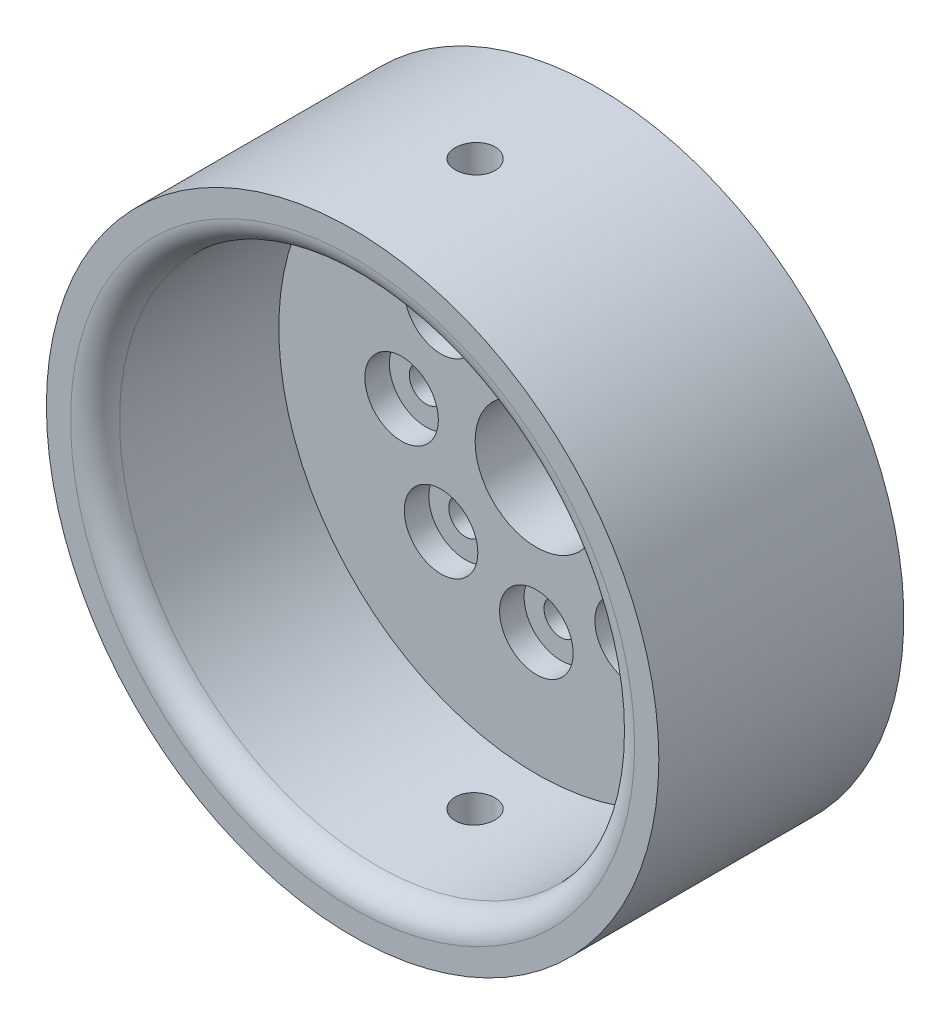
from build123d import *
from build123d.topology import SkipClean

# Parameters (mm, degrees)
SKETCH1_R               = 25
SKETCH1_R_2             = 20.15
BOSS_EXTRUDE1_DEPTH     = 10
BOSS_EXTRUDE2_START     = 5
SKETCH2_R               = 25
SKETCH2_R_2             = 1.375
SKETCH2_R_3             = 5
BOSS_EXTRUDE2_DEPTH     = 5
SKETCH3_R               = 3
CUT_EXTRUDE1_DEPTH      = 2
CUT_EXTRUDE2_DEPTH      = 38
CUT_EXTRUDE2_DEPTH_BACK = 33
SKETCH4_R               = 1.625
SKETCH5_R               = 21.025
CUT_EXTRUDE3_DEPTH      = 10
SKETCH6_R               = 25
SKETCH6_R_2             = 21.025
BOSS_EXTRUDE3_DEPTH     = 5
FILLET1_R               = 2


with BuildPart() as part:
    # Sketch1 → Boss-Extrude1 (new body)
    with BuildSketch(Plane.XY):
        Circle(SKETCH1_R)
        Circle(SKETCH1_R_2, mode=Mode.SUBTRACT)
    extrude(amount=BOSS_EXTRUDE1_DEPTH)

    # Sketch2 → Boss-Extrude2 (add)
    with BuildSketch(Plane(origin=(0, 0, 0), x_dir=(-1, 0, 0), z_dir=(0, 0, -1)).offset(BOSS_EXTRUDE2_START)):
        Circle(SKETCH2_R)
        with Locations((-11, 0)):
            Circle(SKETCH2_R_2, mode=Mode.SUBTRACT)
        with Locations((-7.778174593, 7.778174593)):
            Circle(SKETCH2_R_2, mode=Mode.SUBTRACT)
        with Locations((0, 11)):
            Circle(SKETCH2_R_2, mode=Mode.SUBTRACT)
        with Locations((7.778174593, 7.778174593)):
            Circle(SKETCH2_R_2, mode=Mode.SUBTRACT)
        with Locations((11, 0)):
            Circle(SKETCH2_R_2, mode=Mode.SUBTRACT)
        with Locations((7.778174593, -7.778174593)):
            Circle(SKETCH2_R_2, mode=Mode.SUBTRACT)
        with Locations((0, -11)):
            Circle(SKETCH2_R_2, mode=Mode.SUBTRACT)
        with Locations((-7.778174593, -7.778174593)):
            Circle(SKETCH2_R_2, mode=Mode.SUBTRACT)
        Circle(SKETCH2_R_3, mode=Mode.SUBTRACT)
    extrude(amount=-BOSS_EXTRUDE2_DEPTH)

    # Sketch3 → Cut-Extrude1 (cut)
    with BuildSketch(Plane.XY):
        with Locations((0, 11)):
            Circle(SKETCH3_R)
        with Locations((7.778174593, 7.778174593)):
            Circle(SKETCH3_R)
        with Locations((11, 0)):
            Circle(SKETCH3_R)
        with Locations((7.778174593, -7.778174593)):
            Circle(SKETCH3_R)
        with Locations((0, -11)):
            Circle(SKETCH3_R)
        with Locations((-7.778174593, -7.778174593)):
            Circle(SKETCH3_R)
        with Locations((-11, 0)):
            Circle(SKETCH3_R)
        with Locations((-7.778174593, 7.778174593)):
            Circle(SKETCH3_R)
    extrude(amount=-CUT_EXTRUDE1_DEPTH, mode=Mode.SUBTRACT)

    # Sketch4 → Cut-Extrude2 (cut, two sides: drawn at the far end of the back side and taken through both)
    with BuildSketch(Plane(origin=(0, 0, 0), x_dir=(1, 0, 0), z_dir=(0, 1, 0)).offset(-CUT_EXTRUDE2_DEPTH_BACK)):
        with Locations(Location((0, -5, 0), (0, 0, 90))):
            Circle(SKETCH4_R)
    extrude(amount=CUT_EXTRUDE2_DEPTH + CUT_EXTRUDE2_DEPTH_BACK, mode=Mode.SUBTRACT)

    # Sketch5 → Cut-Extrude3 (cut)
    with BuildSketch(Plane.XY.offset(10)):
        Circle(SKETCH5_R)
    extrude(amount=-CUT_EXTRUDE3_DEPTH, mode=Mode.SUBTRACT)

    # Sketch6 → Boss-Extrude3 (add)
    with SkipClean():  # the faces are left unmerged after this step: merging them gives an invalid solid
        with BuildSketch(Plane.XY.offset(10)):
            with Locations(Location((0, 0, 0), (0, 0, 180))):
                Circle(SKETCH6_R)
            Circle(SKETCH6_R_2, mode=Mode.SUBTRACT)
        extrude(amount=BOSS_EXTRUDE3_DEPTH)

    # Fillet1
    fillet1_edges = [part.edges().sort_by_distance(p)[0] for p in [
        (-21.025, 0, 15),
    ]]
    fillet(fillet1_edges, radius=FILLET1_R)


solid = part.part
